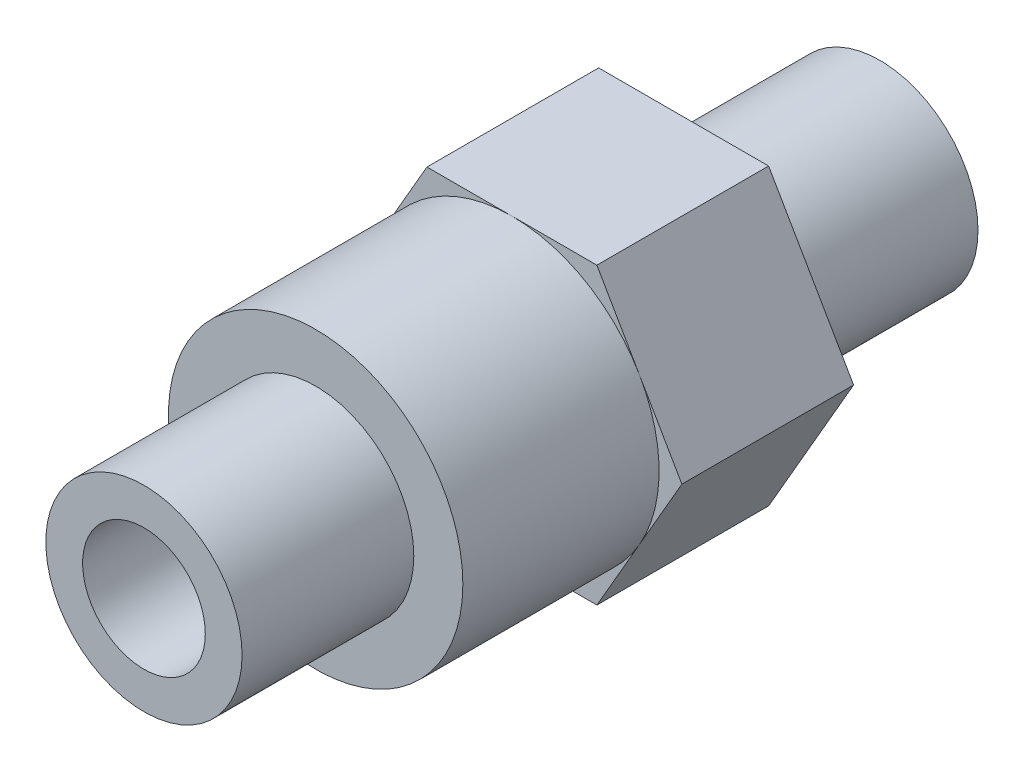
from build123d import *

# Parameters (mm, degrees)
SKETCH1_R           = 4
BOSS_EXTRUDE1_DEPTH = 7
SKETCH1_3_R         = 4
SKETCH1_3_R_2       = 2.5
BOSS_EXTRUDE2_DEPTH = 15
BOSS_EXTRUDE3_START = 8
SKETCH1_4_R         = 4
BOSS_EXTRUDE3_DEPTH = 8
BOSS_EXTRUDE4_START = 15
SKETCH1_5_R         = 4
SKETCH1_5_R_2       = 2.5
BOSS_EXTRUDE4_DEPTH = 15


with BuildPart() as part:
    # Sketch1 → Boss-Extrude1 (new body)
    with BuildSketch(Plane.XY):
        Polygon((6.92820323, 0), (3.464101615, 6), (-3.464101615, 6), (-6.92820323, 0), (-3.464101615, -6), (3.464101615, -6), align=None)
        Circle(SKETCH1_R, mode=Mode.SUBTRACT)
    extrude(amount=-BOSS_EXTRUDE1_DEPTH)

    # Sketch1<3> → Boss-Extrude2 (add)
    with BuildSketch(Plane.XY):
        Circle(SKETCH1_3_R)
        Circle(SKETCH1_3_R_2, mode=Mode.SUBTRACT)
    extrude(amount=-BOSS_EXTRUDE2_DEPTH)

    # Sketch1<4> → Boss-Extrude3 (add)
    with BuildSketch(Plane.XY.offset(BOSS_EXTRUDE3_START)):
        with BuildLine():
            ThreePointArc((6, 0), (5.795555021, 1.552914036), (5.196152666, 2.999999578))
            ThreePointArc((5.196152666, 2.999999578), (3.000000209, 5.196152302), (-3e-09, 6))
            ThreePointArc((-3e-09, 6), (-3.000000081, 5.196152376), (-5.196152514, 2.999999842))
            ThreePointArc((-5.196152514, 2.999999842), (-6, 1.76e-07), (-5.19615269, -2.999999537))
            ThreePointArc((-5.19615269, -2.999999537), (-3.000000229, -5.19615229), (5e-09, -6))
            ThreePointArc((5e-09, -6), (3.000000007, -5.196152419), (5.196152428, -2.999999991))
            ThreePointArc((5.196152428, -2.999999991), (5.795554959, -1.552914265), (6, 0))
        make_face()
        Circle(SKETCH1_4_R, mode=Mode.SUBTRACT)
    extrude(amount=-BOSS_EXTRUDE3_DEPTH)

    # Sketch1<5> → Boss-Extrude4 (add)
    with BuildSketch(Plane.XY.offset(BOSS_EXTRUDE4_START)):
        Circle(SKETCH1_5_R)
        Circle(SKETCH1_5_R_2, mode=Mode.SUBTRACT)
    extrude(amount=-BOSS_EXTRUDE4_DEPTH)


solid = part.part
